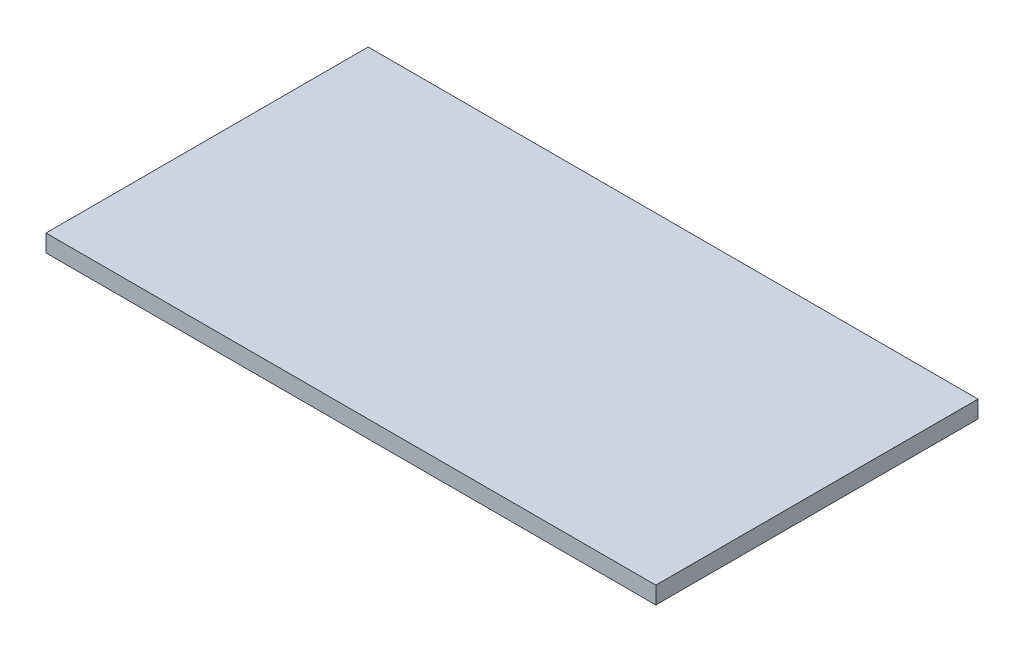
from build123d import *

# Parameters (mm, degrees)
SKETCH1_W           = 212
SKETCH1_H           = 112
BOSS_EXTRUDE1_DEPTH = 6


with BuildPart() as part:
    # Sketch1 → Boss-Extrude1 (new body)
    with BuildSketch(Plane(origin=(0, 0, 0), x_dir=(1, 0, 0), z_dir=(0, 1, 0))):
        with Locations((106, 56)):
            Rectangle(SKETCH1_W, SKETCH1_H)
    extrude(amount=BOSS_EXTRUDE1_DEPTH)


solid = part.part
